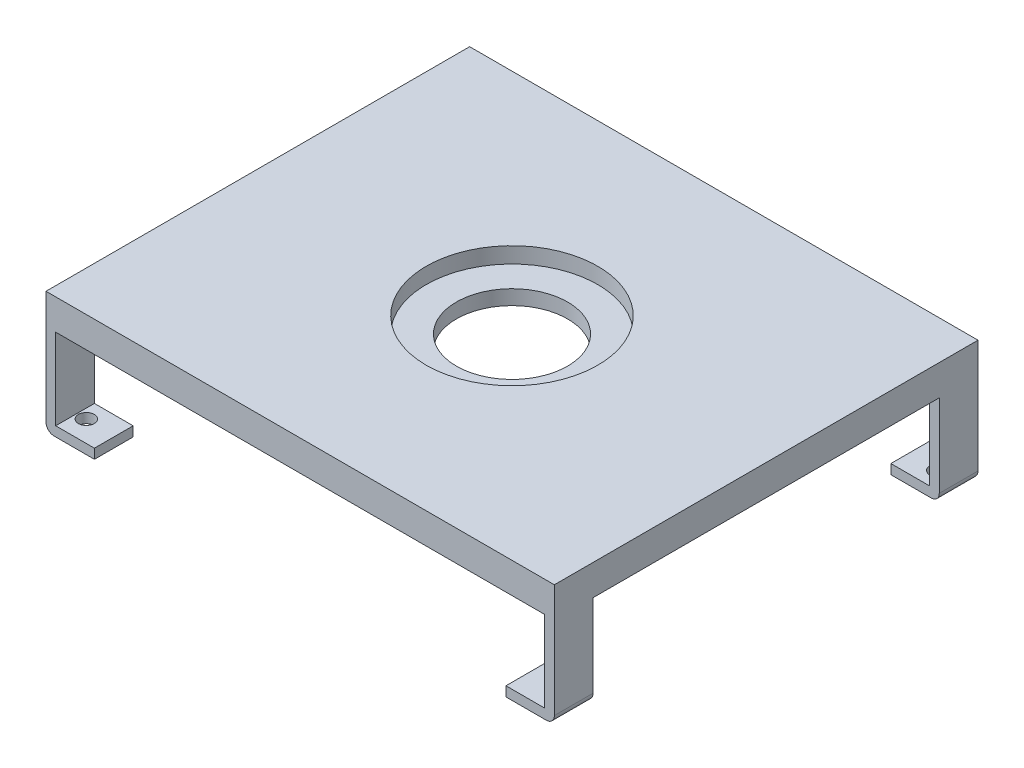
from build123d import *

# Parameters (mm, degrees)
BOSS_EXTRU_1_DEPTH      = 133.35
ESQUISSE3_W             = 108.966
ESQUISSE3_H             = 28.58
ENL_V_MAT_EXTRU_1_DEPTH = 212.421528942
CONG_1_R                = 2.54
SKETCH1_W               = 160.02
SKETCH1_H               = 133.35
BOSS_EXTRUDE1_DEPTH     = 2
SKETCH2_R               = 17.5
CUT_EXTRUDE1_DEPTH      = 161.134514081
SKETCH2_3_R             = 27
SKETCH2_3_R_2           = 17.5
CUT_EXTRUDE2_DEPTH      = 5
SKETCH3_R               = 2.5
CUT_EXTRUDE3_DEPTH      = 5


with BuildPart() as part:
    # Esquisse2 → Boss.-Extru.1 (new body)
    with BuildSketch(Plane.XY):
        Polygon((-64.77, 0), (-80.01, 0), (-80.01, 36.2), (80.01, 36.2), (80.01, 0), (64.77, 0), (64.77, 3.048), (76.962, 3.048), (76.962, 28.58), (-76.962, 28.58), (-76.962, 3.048), (-64.77, 3.048), align=None)
    extrude(amount=BOSS_EXTRU_1_DEPTH)

    # Esquisse3 → Enlèv. mat.-Extru.1 (cut, through all)
    with BuildSketch(Plane.ZY.offset(80.01)):
        with Locations((66.675, 14.29)):
            Rectangle(ESQUISSE3_W, ESQUISSE3_H)
    extrude(amount=-ENL_V_MAT_EXTRU_1_DEPTH, mode=Mode.SUBTRACT)

    # Congé1
    cong_1_edges = [part.edges().sort_by_distance(p)[0] for p in [
        (-80.01, 0, 127.254),
        (-80.01, 0, 6.096),
        (80.01, 0, 127.254),
        (80.01, 0, 6.096),
    ]]
    fillet(cong_1_edges, radius=CONG_1_R)

    # Sketch1 → Boss-Extrude1 (add)
    with BuildSketch(Plane(origin=(0, 36.2, 0), x_dir=(1, 0, 0), z_dir=(0, 1, 0))):
        with Locations((0, -66.675)):
            Rectangle(SKETCH1_W, SKETCH1_H)
    extrude(amount=BOSS_EXTRUDE1_DEPTH)

    # Sketch2 → Cut-Extrude1 (cut, through all)
    with BuildSketch(Plane(origin=(0, 38.2, 0), x_dir=(1, 0, 0), z_dir=(0, 1, 0))):
        with Locations((0, -66.675)):
            Circle(SKETCH2_R)
    extrude(amount=-CUT_EXTRUDE1_DEPTH, mode=Mode.SUBTRACT)

    # Sketch2<3> → Cut-Extrude2 (cut)
    with BuildSketch(Plane(origin=(0, 38.2, 0), x_dir=(1, 0, 0), z_dir=(0, 1, 0))):
        with Locations((0, -66.675)):
            Circle(SKETCH2_3_R)
        with Locations((0, -66.675)):
            Circle(SKETCH2_3_R_2, mode=Mode.SUBTRACT)
    extrude(amount=-CUT_EXTRUDE2_DEPTH, mode=Mode.SUBTRACT)

    # Sketch3 → Cut-Extrude3 (cut)
    with BuildSketch(Plane.XZ):
        with Locations((-74, 126.675)):
            Circle(SKETCH3_R)
        with Locations((74, 126.675)):
            Circle(SKETCH3_R)
        with Locations((74, 6.675)):
            Circle(SKETCH3_R)
        with Locations((-74, 6.675)):
            Circle(SKETCH3_R)
    extrude(amount=-CUT_EXTRUDE3_DEPTH, mode=Mode.SUBTRACT)


solid = part.part
